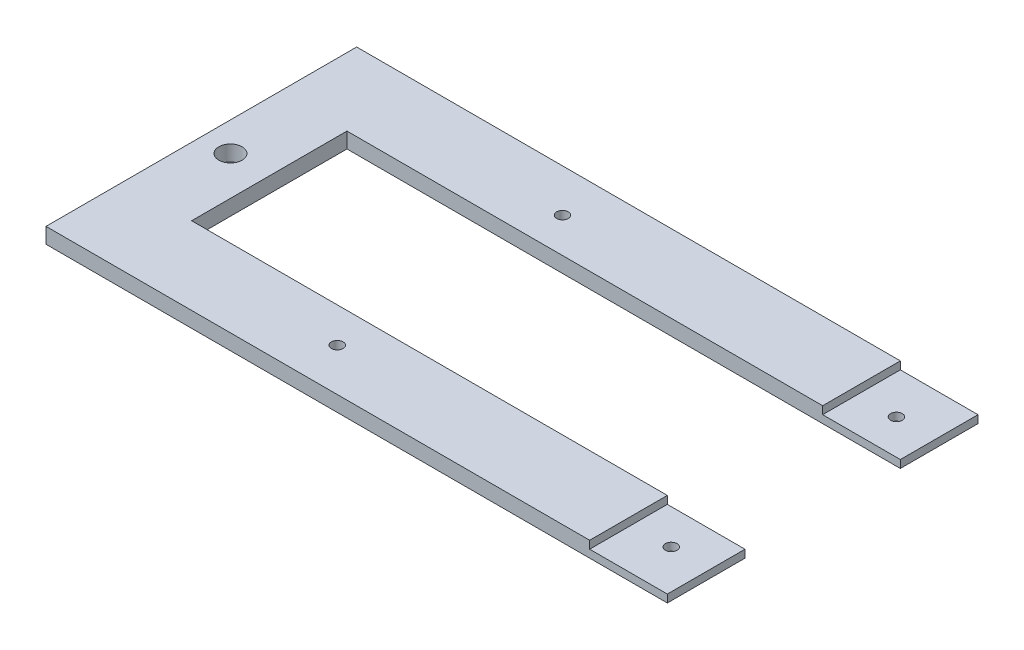
from build123d import *

# Parameters (mm, degrees)
SKETCH1_R           = 1.5
BOSS_EXTRUDE1_DEPTH = 4
SKETCH2_W           = 20
SKETCH2_H           = 2
CUT_EXTRUDE1_DEPTH  = 20


with BuildPart() as part:
    # Sketch1 → Boss-Extrude1 (new body)
    # profile 1 of 2: a face of its own
    with BuildSketch(Plane(origin=(0, 0, 0), x_dir=(1, 0, 0), z_dir=(0, 1, 0))):
        with BuildLine():
            Line((0, 0), (0, -40))
            Line((0, -40), (160, -40))
            Line((160, -40), (160, -20))
            Line((160, -20), (17.5, -20))
            Line((17.5, -20), (17.5, 0))
            Line((17.5, 0), (10.5, 0))
            ThreePointArc((10.5, 0), (7.5, -3), (4.5, 0))
            Line((4.5, 0), (0, 0))
        make_face()
        with Locations(Location((64, -29, 0), (0, 0, 270))):
            Circle(SKETCH1_R, mode=Mode.SUBTRACT)
        with Locations(Location((150, -29, 0), (0, 0, 270))):
            Circle(SKETCH1_R, mode=Mode.SUBTRACT)
    # profile 2 of 2: a face of its own
    with BuildSketch(Plane(origin=(0, 0, 0), x_dir=(1, 0, 0), z_dir=(0, 1, 0))):
        with BuildLine():
            Line((0, 40), (0, 0))
            Line((0, 0), (4.5, 0))
            ThreePointArc((4.5, 0), (7.5, 3), (10.5, 0))
            Line((10.5, 0), (17.5, 0))
            Line((17.5, 0), (17.5, 20))
            Line((17.5, 20), (160, 20))
            Line((160, 20), (160, 40))
            Line((160, 40), (0, 40))
        make_face()
        with Locations(Location((64, 29, 0), (0, 0, 270))):
            Circle(SKETCH1_R, mode=Mode.SUBTRACT)
        with Locations(Location((150, 29, 0), (0, 0, 270))):
            Circle(SKETCH1_R, mode=Mode.SUBTRACT)
    extrude(amount=BOSS_EXTRUDE1_DEPTH)

    # Sketch2 → Cut-Extrude1 (cut)
    with BuildSketch(Plane(origin=(160, 0, 0), x_dir=(0, 0, -1), z_dir=(1, 0, 0))):
        with Locations((30, 3)):
            Rectangle(SKETCH2_W, SKETCH2_H)
        with Locations((-30, 3)):
            Rectangle(SKETCH2_W, SKETCH2_H)
    extrude(amount=-CUT_EXTRUDE1_DEPTH, mode=Mode.SUBTRACT)


solid = part.part
